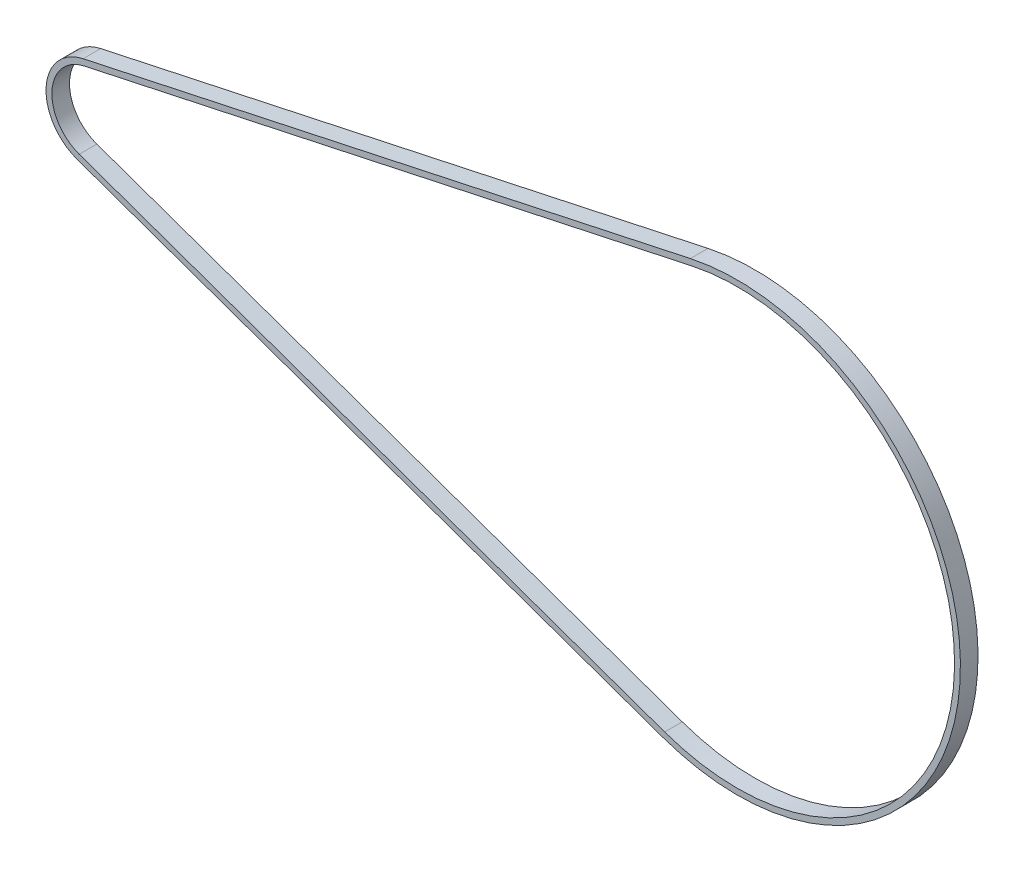
from build123d import *

# Parameters (mm, degrees)
EXTRUDE_THIN1_DEPTH = 3.81


with BuildPart() as part:
    # Sketch2 → Extrude-Thin1 (new, symmetric)
    with BuildSketch(Plane.XY):
        with BuildLine():
            Line((246.483213384, -108.971985363), (-6.791773822, -19.15135004))
            ThreePointArc((-6.791773822, -19.15135004), (-20.277750715, 1.309666352), (-4.271790836, 19.865905543))
            Line((-4.271790836, 19.865905543), (258.453132567, 76.359978657))
            ThreePointArc((258.453132567, 76.359978657), (375.063454934, -24.223987846), (246.483213384, -108.971985363))
        make_face()
        with BuildLine():
            Line((247.332185112, -106.578066608), (-5.942802094, -16.757431285))
            ThreePointArc((-5.942802094, -16.757431285), (-17.743031875, 1.145958058), (-3.737816982, 17.38266735))
            Line((-3.737816982, 17.38266735), (258.987106422, 73.876740464))
            ThreePointArc((258.987106422, 73.876740464), (372.528736094, -24.060279552), (247.332185112, -106.578066608))
        make_face(mode=Mode.SUBTRACT)
    extrude(amount=EXTRUDE_THIN1_DEPTH, both=True)


solid = part.part
